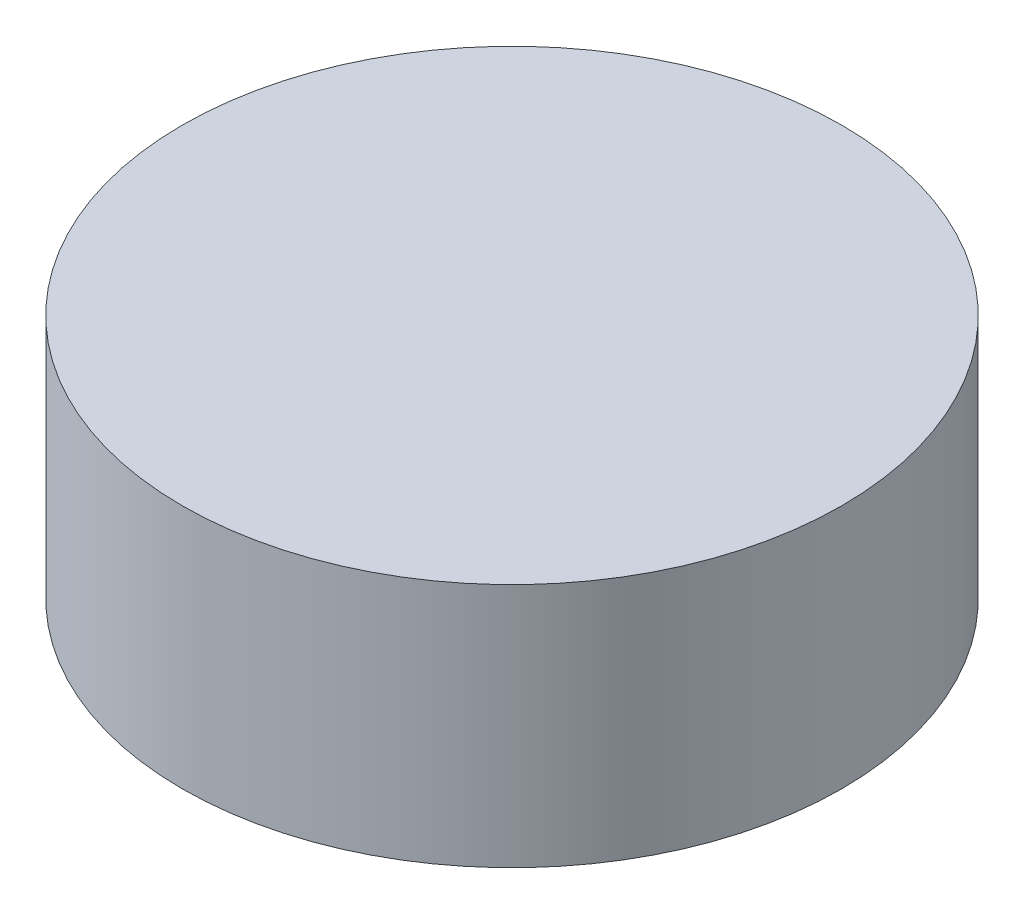
from build123d import *

# Parameters (mm, degrees)
GRIPPING_RIBS_DEPTH = 2.1


with BuildPart() as part:
    # Sketch1 → Main Body (revolve)
    with BuildSketch(Plane.XY, mode=Mode.PRIVATE) as main_body_sk:
        Polygon((0, 3.1), (-3.9, 3.1), (-3.9, 0.2), (-3, 0.2), (-3, 0), (-2.5, 0), (-2.5, 2.1), (0, 2.1), align=None)
    revolve(main_body_sk.sketch.rotate(Axis((0, 0, 0), (0, 1, 0)), 270), axis=Axis((0, 0, 0), (0, 1, 0)))

    # Sketch2 → Gripping Ribs (add)
    with BuildSketch(Plane.XZ.offset(-2.1)):
        with BuildLine():
            Line((-0.7, 2.4), (0.7, 2.4))
            ThreePointArc((0.7, 2.4), (0, 2.5), (-0.7, 2.4))
        make_face()
        with BuildLine():
            ThreePointArc((-2.4, 0.7), (-2.5, 0), (-2.4, -0.7))
            Line((-2.4, -0.7), (-2.4, 0.7))
        make_face()
        with BuildLine():
            Line((2.4, 0.7), (2.4, -0.7))
            ThreePointArc((2.4, -0.7), (2.474873734, -0.353553391), (2.5, 0))
            ThreePointArc((2.5, 0), (2.474873734, 0.353553391), (2.4, 0.7))
        make_face()
        with BuildLine():
            ThreePointArc((-0.7, -2.4), (0, -2.5), (0.7, -2.4))
            Line((0.7, -2.4), (-0.7, -2.4))
        make_face()
    extrude(amount=GRIPPING_RIBS_DEPTH)


solid = part.part
